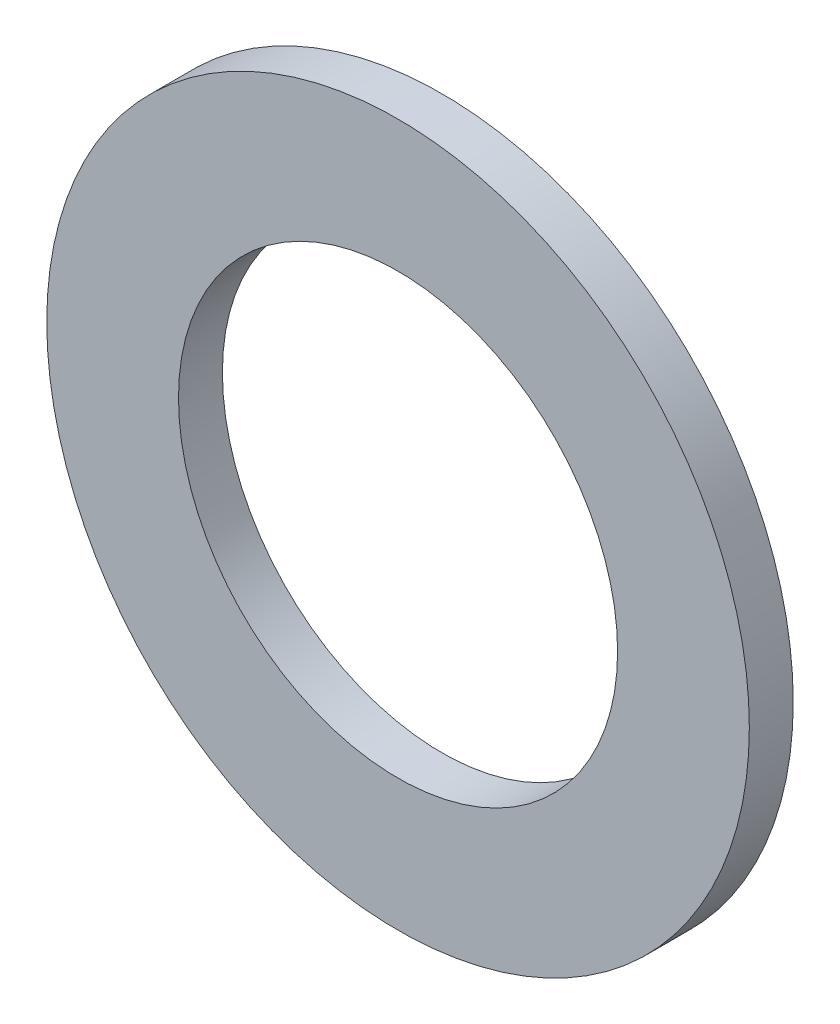
from build123d import *

# Parameters (mm, degrees)
SKETCH_1_R      = 8
SKETCH_1_R_2    = 5
EXTRUDE_1_DEPTH = 1


with BuildPart() as part:
    # 草图1 → 凸台-拉伸1 (new body)
    with BuildSketch(Plane.XY):
        Circle(SKETCH_1_R)
        Circle(SKETCH_1_R_2, mode=Mode.SUBTRACT)
    extrude(amount=EXTRUDE_1_DEPTH)


solid = part.part
